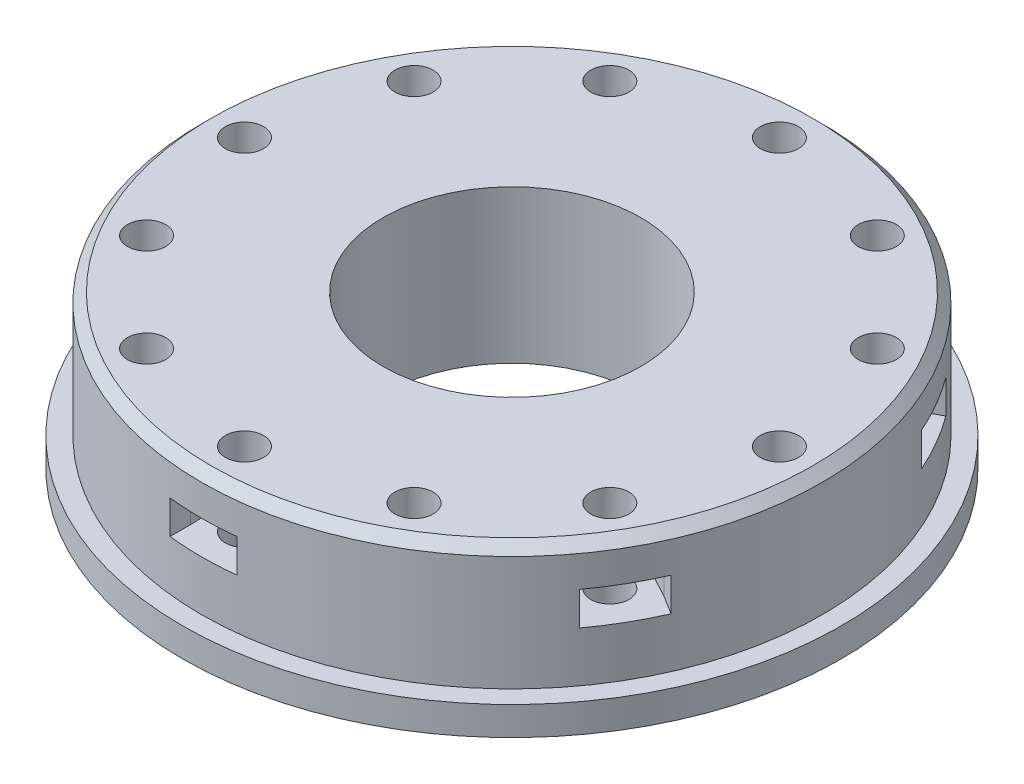
from build123d import *

# Parameters (mm, degrees)
SKETCH_1_R          = 34.5
EXTRUDE_1_DEPTH     = 16
CUT_EXTRUDE_START   = -13
SKETCH_2_R          = 34.5
SKETCH_2_R_2        = 32.5
CUT_EXTRUDE_1_DEPTH = 13
SKETCH_3_R          = 2
CUT_EXTRUDE_3_DEPTH = 52.34685969
SKETCH_7_R          = 13.5
CUT_EXTRUDE_6_DEPTH = 52.34685969
CUT_EXTRUDE_7_DEPTH = 8
CHAMFER_4_SIZE      = 1
CUT_EXTRUDE_8_DEPTH = 1.75
CUT_EXTRUDE_9_REACH = 53.347
SKETCH_11_R         = 2


with BuildPart() as part:
    # 草图1 → 凸台-拉伸1 (new body)
    with BuildSketch(Plane(origin=(0, 0, 0), x_dir=(1, 0, 0), z_dir=(0, 1, 0))):
        with Locations(Location((0, 0, 0), (0, 0, 270))):
            Circle(SKETCH_1_R)
    extrude(amount=EXTRUDE_1_DEPTH)

    # 草图2 → 切除-拉伸1 (cut)
    with BuildSketch(Plane(origin=(0, 16, 0), x_dir=(1, 0, 0), z_dir=(0, 1, 0)).offset(CUT_EXTRUDE_START)):
        with Locations(Location((0, 0, 0), (0, 0, 270))):
            Circle(SKETCH_2_R)
        with Locations(Location((0, 0, 0), (0, 0, 270))):
            Circle(SKETCH_2_R_2, mode=Mode.SUBTRACT)
    extrude(amount=CUT_EXTRUDE_1_DEPTH, mode=Mode.SUBTRACT)

    # 草图3 → 切除-拉伸3 (cut, through all)
    with BuildSketch(Plane(origin=(0, 16, 0), x_dir=(1, 0, 0), z_dir=(0, 1, 0))):
        with Locations(Location((-28, 0, 0), (0, 0, 270))):
            Circle(SKETCH_3_R)
        with Locations(Location((-14, 24.248711306, 0), (0, 0, 270))):
            Circle(SKETCH_3_R)
        with Locations(Location((14, 24.248711306, 0), (0, 0, 270))):
            Circle(SKETCH_3_R)
        with Locations(Location((28, 0, 0), (0, 0, 270))):
            Circle(SKETCH_3_R)
        with Locations(Location((14, -24.248711306, 0), (0, 0, 270))):
            Circle(SKETCH_3_R)
        with Locations(Location((-14, -24.248711306, 0), (0, 0, 270))):
            Circle(SKETCH_3_R)
    extrude(amount=-CUT_EXTRUDE_3_DEPTH, mode=Mode.SUBTRACT)

    # 草图7 → 切除-拉伸6 (cut, through all)
    with BuildSketch(Plane(origin=(0, 16, 0), x_dir=(1, 0, 0), z_dir=(0, 1, 0))):
        with Locations(Location((0, 0, 0), (0, 0, 270))):
            Circle(SKETCH_7_R)
    extrude(amount=-CUT_EXTRUDE_6_DEPTH, mode=Mode.SUBTRACT)

    # 草图8 → 切除-拉伸7 (cut)
    with BuildSketch(Plane.XZ):
        Polygon((14.841047387, -20.236732664), (10.94604827, -21.514353582), (10.105000883, -25.526332224), (13.158952613, -28.260689948), (17.05395173, -26.98306903), (17.894999117, -22.971090388), align=None)
        Polygon((31.894999117, 1.277620918), (28.841047387, 4.011978642), (24.94604827, 2.734357724), (24.105000883, -1.277620918), (27.158952613, -4.011978642), (31.05395173, -2.734357724), align=None)
        Polygon((-10.105000883, -22.971090388), (-13.158952613, -20.236732664), (-17.05395173, -21.514353582), (-17.894999117, -25.526332224), (-14.841047387, -28.260689948), (-10.94604827, -26.98306903), align=None)
        Polygon((-24.94604827, -2.734357724), (-24.105000883, 1.277620918), (-27.158952613, 4.011978642), (-31.05395173, 2.734357724), (-31.894999117, -1.277620918), (-28.841047387, -4.011978642), align=None)
        Polygon((-14.841047387, 20.236732664), (-10.94604827, 21.514353582), (-10.105000883, 25.526332224), (-13.158952613, 28.260689948), (-17.05395173, 26.98306903), (-17.894999117, 22.971090388), align=None)
        Polygon((10.105000883, 22.971090388), (13.158952613, 20.236732664), (17.05395173, 21.514353582), (17.894999117, 25.526332224), (14.841047387, 28.260689948), (10.94604827, 26.98306903), align=None)
    extrude(amount=-CUT_EXTRUDE_7_DEPTH, mode=Mode.SUBTRACT)

    # 倒角4
    chamfer_4_edges = [part.edges().sort_by_distance(p)[0] for p in [
        (0, 16, -32.5),
    ]]
    chamfer(chamfer_4_edges, length=CHAMFER_4_SIZE)

    # 草图10 → 切除-拉伸8 (cut, symmetric)
    with BuildSketch(Plane(origin=(0, 10, 0), x_dir=(1, 0, 0), z_dir=(0, 1, 0))):
        Polygon((-3.482371577, -30.162503534), (-3.613968785, -26.065429516), (-0.131597208, -23.902925982), (3.482371577, -25.837496466), (3.613968785, -29.934570484), (3.482371577, -34.323797695), (-3.482371577, -34.323797695), align=None)
        Polygon((-27.86268009, -12.065429516), (-24.380308514, -9.902925982), (-20.766339729, -11.837496466), (-20.634742521, -15.934570484), (-24.117114098, -18.097074018), (-27.98409497, -20.177721098), (-31.466466547, -14.146076596), align=None)
        Polygon((-24.380308514, 18.097074018), (-20.766339729, 16.162503534), (-20.634742521, 12.065429516), (-24.117114098, 9.902925982), (-27.731082883, 11.837496466), (-31.466466547, 14.146076596), (-27.98409497, 20.177721098), align=None)
        Polygon((3.482371577, 30.162503534), (3.613968785, 26.065429516), (0.131597208, 23.902925982), (-3.482371577, 25.837496466), (-3.613968785, 29.934570484), (-3.482371577, 34.323797695), (3.482371577, 34.323797695), align=None)
        Polygon((27.86268009, 12.065429516), (24.380308514, 9.902925982), (20.766339729, 11.837496466), (20.634742521, 15.934570484), (24.117114098, 18.097074018), (27.98409497, 20.177721098), (31.466466547, 14.146076596), align=None)
        Polygon((24.380308514, -18.097074018), (20.766339729, -16.162503534), (20.634742521, -12.065429516), (24.117114098, -9.902925982), (27.731082883, -11.837496466), (31.466466547, -14.146076596), (27.98409497, -20.177721098), align=None)
    extrude(amount=CUT_EXTRUDE_8_DEPTH, both=True, mode=Mode.SUBTRACT)

    # 切除-拉伸9: up to this face of the body (flat: up to its plane)
    cut_extrude_9_end = Plane(part.part.faces().sort_by_distance((0, 16, -30.609045456))[0])
    # 草图11 → 切除-拉伸9 (cut, up to the picked face)
    with BuildSketch(Plane.XZ, mode=Mode.PRIVATE) as cut_extrude_9_sk1:
        with Locations(Location((0, 28, 0), (0, 0, 270))):
            Circle(SKETCH_11_R)
    cut_extrude_9_tool1 = split(extrude(cut_extrude_9_sk1.sketch, amount=-CUT_EXTRUDE_9_REACH, mode=Mode.PRIVATE), bisect_by=cut_extrude_9_end, keep=Keep.BOTH, mode=Mode.PRIVATE)
    # 草图11 → 切除-拉伸9 (cut, up to the picked face)
    with BuildSketch(Plane.XZ, mode=Mode.PRIVATE) as cut_extrude_9_sk2:
        with Locations(Location((24.248711306, 14, 0), (0, 0, 270))):
            Circle(SKETCH_11_R)
    cut_extrude_9_tool2 = split(extrude(cut_extrude_9_sk2.sketch, amount=-CUT_EXTRUDE_9_REACH, mode=Mode.PRIVATE), bisect_by=cut_extrude_9_end, keep=Keep.BOTH, mode=Mode.PRIVATE)
    # 草图11 → 切除-拉伸9 (cut, up to the picked face)
    with BuildSketch(Plane.XZ, mode=Mode.PRIVATE) as cut_extrude_9_sk3:
        with Locations(Location((24.248711306, -14, 0), (0, 0, 270))):
            Circle(SKETCH_11_R)
    cut_extrude_9_tool3 = split(extrude(cut_extrude_9_sk3.sketch, amount=-CUT_EXTRUDE_9_REACH, mode=Mode.PRIVATE), bisect_by=cut_extrude_9_end, keep=Keep.BOTH, mode=Mode.PRIVATE)
    # 草图11 → 切除-拉伸9 (cut, up to the picked face)
    with BuildSketch(Plane.XZ, mode=Mode.PRIVATE) as cut_extrude_9_sk4:
        with Locations(Location((0, -28, 0), (0, 0, 270))):
            Circle(SKETCH_11_R)
    cut_extrude_9_tool4 = split(extrude(cut_extrude_9_sk4.sketch, amount=-CUT_EXTRUDE_9_REACH, mode=Mode.PRIVATE), bisect_by=cut_extrude_9_end, keep=Keep.BOTH, mode=Mode.PRIVATE)
    # 草图11 → 切除-拉伸9 (cut, up to the picked face)
    with BuildSketch(Plane.XZ, mode=Mode.PRIVATE) as cut_extrude_9_sk5:
        with Locations(Location((-24.248711306, -14, 0), (0, 0, 270))):
            Circle(SKETCH_11_R)
    cut_extrude_9_tool5 = split(extrude(cut_extrude_9_sk5.sketch, amount=-CUT_EXTRUDE_9_REACH, mode=Mode.PRIVATE), bisect_by=cut_extrude_9_end, keep=Keep.BOTH, mode=Mode.PRIVATE)
    # 草图11 → 切除-拉伸9 (cut, up to the picked face)
    with BuildSketch(Plane.XZ, mode=Mode.PRIVATE) as cut_extrude_9_sk6:
        with Locations(Location((-24.248711306, 14, 0), (0, 0, 270))):
            Circle(SKETCH_11_R)
    cut_extrude_9_tool6 = split(extrude(cut_extrude_9_sk6.sketch, amount=-CUT_EXTRUDE_9_REACH, mode=Mode.PRIVATE), bisect_by=cut_extrude_9_end, keep=Keep.BOTH, mode=Mode.PRIVATE)
    add(cut_extrude_9_tool1.solids().sort_by(Axis((0, 0, 28), (0, 1, 0)))[0], mode=Mode.SUBTRACT)
    add(cut_extrude_9_tool2.solids().sort_by(Axis((24.248711, 0, 14), (0, 1, 0)))[0], mode=Mode.SUBTRACT)
    add(cut_extrude_9_tool3.solids().sort_by(Axis((24.248711, 0, -14), (0, 1, 0)))[0], mode=Mode.SUBTRACT)
    add(cut_extrude_9_tool4.solids().sort_by(Axis((0, 0, -28), (0, 1, 0)))[0], mode=Mode.SUBTRACT)
    add(cut_extrude_9_tool5.solids().sort_by(Axis((-24.248711, 0, -14), (0, 1, 0)))[0], mode=Mode.SUBTRACT)
    add(cut_extrude_9_tool6.solids().sort_by(Axis((-24.248711, 0, 14), (0, 1, 0)))[0], mode=Mode.SUBTRACT)


solid = part.part
